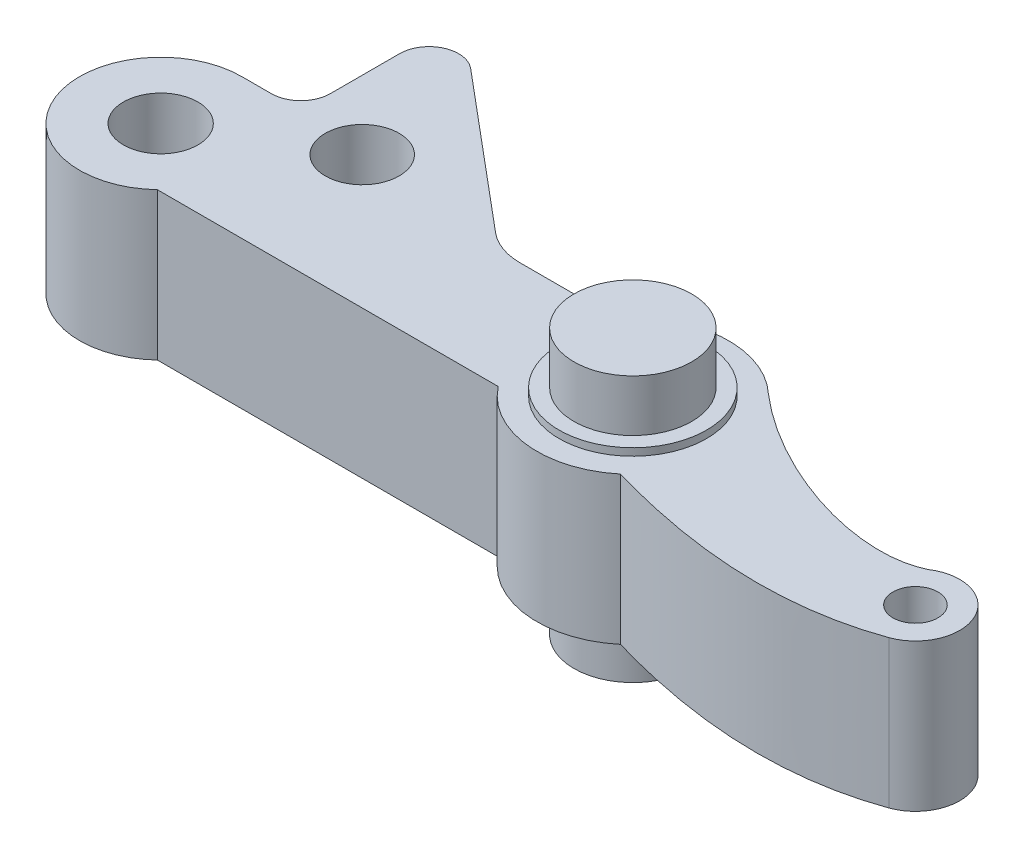
from build123d import *

# Parameters (mm, degrees)
EXTRUDE_1_DEPTH     = 10
HOLE_WIZARD_1_D     = 3.05
HOLE_WIZARD_1_DEPTH = 14
HOLE_WIZARD_2_D     = 5.01
HOLE_WIZARD_2_DEPTH = 14
HOLE_WIZARD_3_D     = 5.05
HOLE_WIZARD_3_DEPTH = 14
FILLET_1_R          = 2
FILLET_2_R          = 4


with BuildPart() as part:
    # 草图1 → 凸台-拉伸1 (new body)
    with BuildSketch(Plane.XZ):
        with BuildLine():
            Line((-28, -5.5), (-28, -12.193872478))
            ThreePointArc((-28, -12.193872478), (-26.845236523, -14.006488052), (-24.714424781, -13.725961365))
            Line((-24.714424781, -13.725961365), (-13.123475383, -4))
            Line((-13.123475383, -4), (-5.123475383, -4))
            ThreePointArc((-5.123475383, -4), (-0.488094847, -6.481648202), (4.466659496, -4.722176717))
            add(Edge.make_bspline(
                [(20.490071148, 0), (14.378134184, 3.89268165), (4.466659496, -4.722176717)],
                knots=[0.252803303, 0.252803303, 0.252803303, 2.064431363, 2.064431363, 2.064431363], degree=2, weights=[1, 0.617045201, 1]))
            ThreePointArc((20.490071148, 0), (24.593372298, 1.499185377), (22.849655998, 5.50469291))
            add(Edge.make_bspline(
                [(4.159420521, 4.994919512), (11.553776754, 7.153354998), (17.783855246, 7.323279465), (22.849655998, 5.50469291)],
                knots=[0, 0, 0, 0, 1, 1, 1, 1], degree=3))
            ThreePointArc((4.159420521, 4.994919512), (-0.692687991, 6.462985637), (-5.123475383, 4))
            Line((-5.123475383, 4), (-28.225082782, 4))
            ThreePointArc((-28.225082782, 4), (-37.111262075, 2.031009601), (-32, -5.5))
            Line((-32, -5.5), (-28, -5.5))
        make_face()
    extrude(amount=-EXTRUDE_1_DEPTH)

    # 草图2 → 旋转1 (revolve)
    with BuildSketch(Plane(origin=(0, 0, 0), x_dir=(-1, 0, 0), z_dir=(0, 0, -1)), mode=Mode.PRIVATE) as revolve_1_sk:
        Polygon((-3.99, -4), (0, -4), (0, 0), (-5, 0), (-5, -0.5), (-3.99, -0.5), align=None)
    revolve(revolve_1_sk.sketch.rotate(Axis((0, -4, 0), (0, 1, 0)), 270), axis=Axis((0, -4, 0), (0, 1, 0)))

    # 草图3 → 旋转2 (revolve)
    with BuildSketch(Plane.XY, mode=Mode.PRIVATE) as revolve_2_sk:
        Polygon((3.99, 14), (0, 14), (0, 10), (5, 10), (5, 10.5), (3.99, 10.5), align=None)
    revolve(revolve_2_sk.sketch.rotate(Axis((0, 14, 0), (0, -1, 0)), 270), axis=Axis((0, 14, 0), (0, -1, 0)))

    # 孔1
    with Locations(Plane(origin=(0, 10, 0), x_dir=(1, 0, 0), z_dir=(0, 1, 0))):
        with Locations((21.836015336, -2.681125555)):
            Hole(HOLE_WIZARD_1_D / 2, depth=HOLE_WIZARD_1_DEPTH)

    # 孔2
    with Locations(Plane(origin=(0, 10, 0), x_dir=(1, 0, 0), z_dir=(0, 1, 0))):
        with Locations((-23.339745962, 5)):
            Hole(HOLE_WIZARD_2_D / 2, depth=HOLE_WIZARD_2_DEPTH)

    # 孔3
    with Locations(Plane(origin=(0, 10, 0), x_dir=(1, 0, 0), z_dir=(0, 1, 0))):
        with Locations((-32, 0)):
            Hole(HOLE_WIZARD_3_D / 2, depth=HOLE_WIZARD_3_DEPTH)

    # 圆角1
    fillet_1_edges = [part.edges().sort_by_distance(p)[0] for p in [
        (-28, 5, -5.5),
    ]]
    fillet(fillet_1_edges, radius=FILLET_1_R)

    # 圆角2
    fillet_2_edges = [part.edges().sort_by_distance(p)[0] for p in [
        (-13.123475383, 5, -4),
    ]]
    fillet(fillet_2_edges, radius=FILLET_2_R)


solid = part.part
